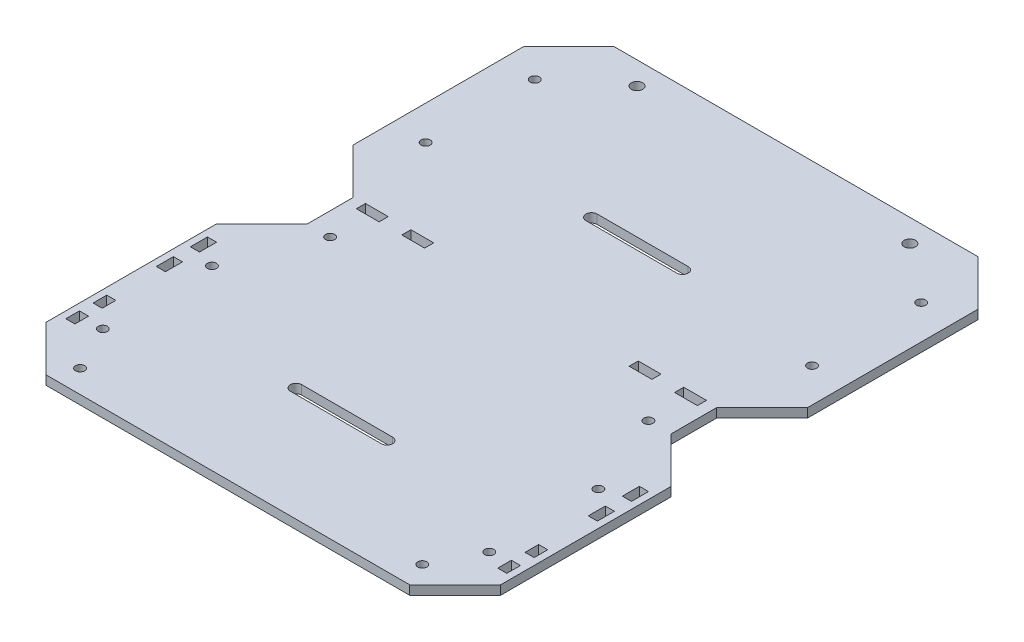
from build123d import *

# Parameters (mm, degrees)
SKETCH1_R           = 2
SKETCH1_R_2         = 2.5
SKETCH1_W           = 4
SKETCH1_H           = 7.5
SKETCH1_H_2         = 6
SKETCH1_W_2         = 10
SKETCH1_H_3         = 4
BOSS_EXTRUDE1_DEPTH = 4


with BuildPart() as part:
    # Sketch1 → Boss-Extrude1 (new body)
    with BuildSketch(Plane(origin=(0, 0, 0), x_dir=(1, 0, 0), z_dir=(0, 1, 0))):
        Polygon((-80, -10.54257408), (-80, 9.45742592), (-100, 29.45742592), (-100, 104.45742592), (-80, 124.45742592), (80, 124.45742592), (100, 104.45742592), (100, 29.45742592), (80, 9.45742592), (80, -10.54257408), (100, -30.54257408), (100, -105.54257408), (80, -125.54257408), (-80, -125.54257408), (-100, -105.54257408), (-100, -30.54257408), align=None)
        with Locations(Location((85, 94.45742592, 0), (0, 0, 270))):
            Circle(SKETCH1_R, mode=Mode.SUBTRACT)
        with Locations(Location((85, 46.45742592, 0), (0, 0, 270))):
            Circle(SKETCH1_R, mode=Mode.SUBTRACT)
        with Locations(Location((85, -95.54257408, 0), (0, 0, 90))):
            Circle(SKETCH1_R, mode=Mode.SUBTRACT)
        with Locations(Location((85, -47.54257408, 0), (0, 0, 90))):
            Circle(SKETCH1_R, mode=Mode.SUBTRACT)
        with Locations(Location((-85, 94.45742592, 0), (0, 0, 90))):
            Circle(SKETCH1_R, mode=Mode.SUBTRACT)
        with Locations(Location((-85, 46.45742592, 0), (0, 0, 90))):
            Circle(SKETCH1_R, mode=Mode.SUBTRACT)
        with Locations(Location((-85, -47.54257408, 0), (0, 0, 270))):
            Circle(SKETCH1_R, mode=Mode.SUBTRACT)
        with Locations(Location((-85, -95.54257408, 0), (0, 0, 270))):
            Circle(SKETCH1_R, mode=Mode.SUBTRACT)
        with Locations(Location((60, 114.45742592, 0), (0, 0, 270))):
            Circle(SKETCH1_R_2, mode=Mode.SUBTRACT)
        with Locations(Location((-60, 114.45742592, 0), (0, 0, 90))):
            Circle(SKETCH1_R_2, mode=Mode.SUBTRACT)
        with Locations(Location((-75, -115.54257408, 0), (0, 0, 270))):
            Circle(SKETCH1_R, mode=Mode.SUBTRACT)
        with Locations(Location((-70, -10.54257408, 0), (0, 0, 270))):
            Circle(SKETCH1_R, mode=Mode.SUBTRACT)
        with Locations(Location((75, -115, 0), (0, 0, 270))):
            Circle(SKETCH1_R, mode=Mode.SUBTRACT)
        with Locations(Location((70, -10.54257408, 0), (0, 0, 270))):
            Circle(SKETCH1_R, mode=Mode.SUBTRACT)
        with BuildLine():
            Line((20, -78.04257408), (-20, -78.04257408))
            ThreePointArc((-20, -78.04257408), (-22.5, -75.54257408), (-20, -73.04257408))
            Line((-20, -73.04257408), (20, -73.04257408))
            ThreePointArc((20, -73.04257408), (22.5, -75.54257408), (20, -78.04257408))
        make_face(mode=Mode.SUBTRACT)
        with BuildLine():
            Line((20, 56.95742592), (-20, 56.95742592))
            ThreePointArc((-20, 56.95742592), (-22.5, 54.45742592), (-20, 51.95742592))
            Line((-20, 51.95742592), (20, 51.95742592))
            ThreePointArc((20, 51.95742592), (22.5, 54.45742592), (20, 56.95742592))
        make_face(mode=Mode.SUBTRACT)
        with Locations((95, -41.25)):
            Rectangle(SKETCH1_W, SKETCH1_H, mode=Mode.SUBTRACT)
        with Locations((95, -96.822248533)):
            Rectangle(SKETCH1_W, SKETCH1_H_2, mode=Mode.SUBTRACT)
        with Locations((70, 8)):
            Rectangle(SKETCH1_W_2, SKETCH1_H_3, mode=Mode.SUBTRACT)
        with Locations((95, -56.25)):
            Rectangle(SKETCH1_W, SKETCH1_H, mode=Mode.SUBTRACT)
        with Locations((50, 8)):
            Rectangle(SKETCH1_W_2, SKETCH1_H_3, mode=Mode.SUBTRACT)
        with Locations((95, -84.822248533)):
            Rectangle(SKETCH1_W, SKETCH1_H_2, mode=Mode.SUBTRACT)
        with Locations((-95, -96.822248533)):
            Rectangle(SKETCH1_W, SKETCH1_H_2, mode=Mode.SUBTRACT)
        with Locations((-95, -84.822248533)):
            Rectangle(SKETCH1_W, SKETCH1_H_2, mode=Mode.SUBTRACT)
        with Locations((-95, -56.25)):
            Rectangle(SKETCH1_W, SKETCH1_H, mode=Mode.SUBTRACT)
        with Locations((-95, -41.25)):
            Rectangle(SKETCH1_W, SKETCH1_H, mode=Mode.SUBTRACT)
        with Locations((-50, 8)):
            Rectangle(SKETCH1_W_2, SKETCH1_H_3, mode=Mode.SUBTRACT)
        with Locations((-70, 8)):
            Rectangle(SKETCH1_W_2, SKETCH1_H_3, mode=Mode.SUBTRACT)
    extrude(amount=BOSS_EXTRUDE1_DEPTH)


solid = part.part
